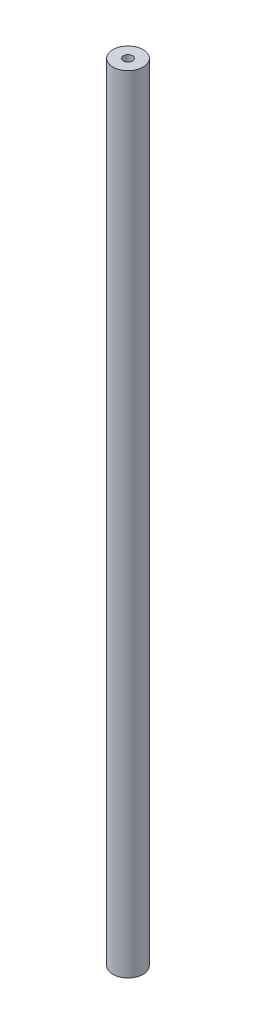
from build123d import *

# Parameters (mm, degrees)
SKETCH1_R           = 2.5
SKETCH1_R_2         = 0.75
BOSS_EXTRUDE1_DEPTH = 130


with BuildPart() as part:
    # Sketch1 → Boss-Extrude1 (new body)
    with BuildSketch(Plane(origin=(0, 0, 0), x_dir=(1, 0, 0), z_dir=(0, 1, 0))):
        with Locations(Location((0, 0, 0), (0, 0, 270))):
            Circle(SKETCH1_R)
        with Locations(Location((0, 0, 0), (0, 0, 270))):
            Circle(SKETCH1_R_2, mode=Mode.SUBTRACT)
    extrude(amount=BOSS_EXTRUDE1_DEPTH)


solid = part.part
